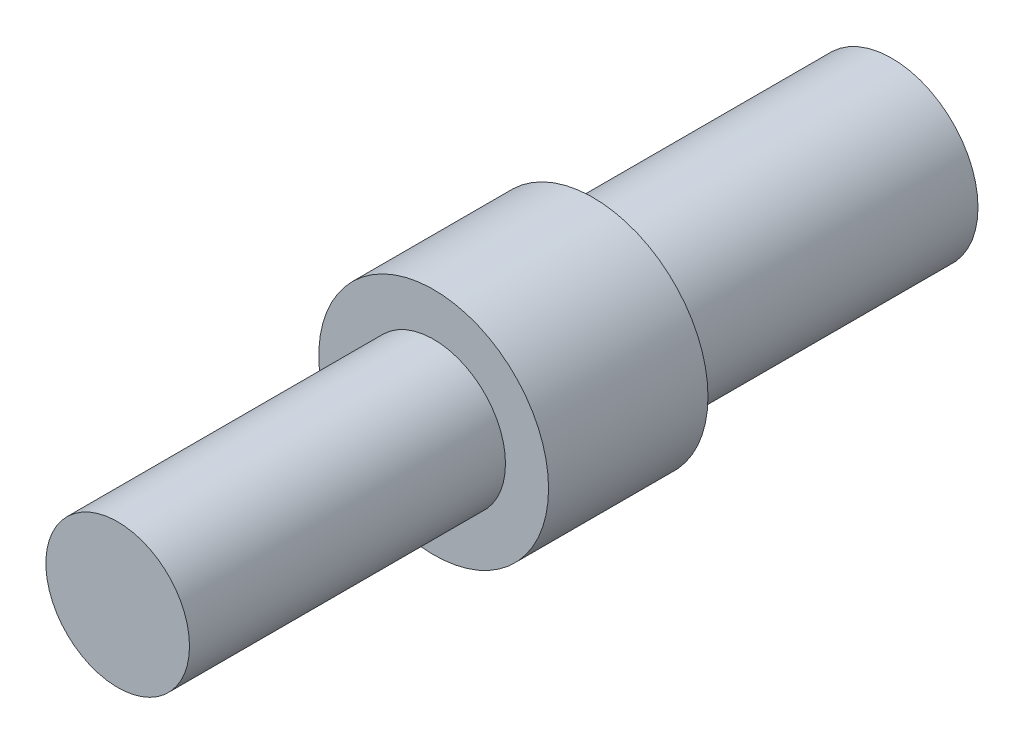
from build123d import *

# Parameters (mm, degrees)
S01_12_MM_BEARING_JOURNAL_R                  = 6
F_01_12_MM_BEARING_JOURNAL_DEPTH             = 20.8
F_02_START                                   = 20.8
S02_GROUNDED_JOURNAL_SHOULDER_R              = 8
F_02_GROUNDED_JOURNAL_SHOULDER_DEPTH         = 11.1
F_03_START                                   = 31.9
S03_M10_THREADED_BRIDGE_STEM_R               = 5
F_03_M10_THREADED_BRIDGE_STEM_DEPTH          = 22
F_04_START                                   = -0.1
S04_M5_TAPPED_END_NOMINAL_THREAD_ENV_R       = 2.53
F_04_M5_TAPPED_END_NOMINAL_THREAD_ENVE_DEPTH = 9.1


with BuildPart() as part:
    # S01 - 12 mm bearing journal → 01 - 12 mm bearing journal (new body)
    with BuildSketch(Plane.XY):
        Circle(S01_12_MM_BEARING_JOURNAL_R)
    extrude(amount=F_01_12_MM_BEARING_JOURNAL_DEPTH)

    # S02 - Grounded journal shoulder → 02 - Grounded journal shoulder (add)
    with BuildSketch(Plane.XY.offset(F_02_START)):
        Circle(S02_GROUNDED_JOURNAL_SHOULDER_R)
    extrude(amount=F_02_GROUNDED_JOURNAL_SHOULDER_DEPTH)

    # S03 - M10 threaded bridge stem → 03 - M10 threaded bridge stem (add)
    with BuildSketch(Plane.XY.offset(F_03_START)):
        Circle(S03_M10_THREADED_BRIDGE_STEM_R)
    extrude(amount=F_03_M10_THREADED_BRIDGE_STEM_DEPTH)

    # S04 - M5 tapped end - nominal thread envelope → 04 - M5 tapped end - nominal thread envelope (cut)
    with BuildSketch(Plane.XY.offset(F_04_START)):
        Circle(S04_M5_TAPPED_END_NOMINAL_THREAD_ENV_R)
    extrude(amount=F_04_M5_TAPPED_END_NOMINAL_THREAD_ENVE_DEPTH, mode=Mode.SUBTRACT)


solid = part.part
